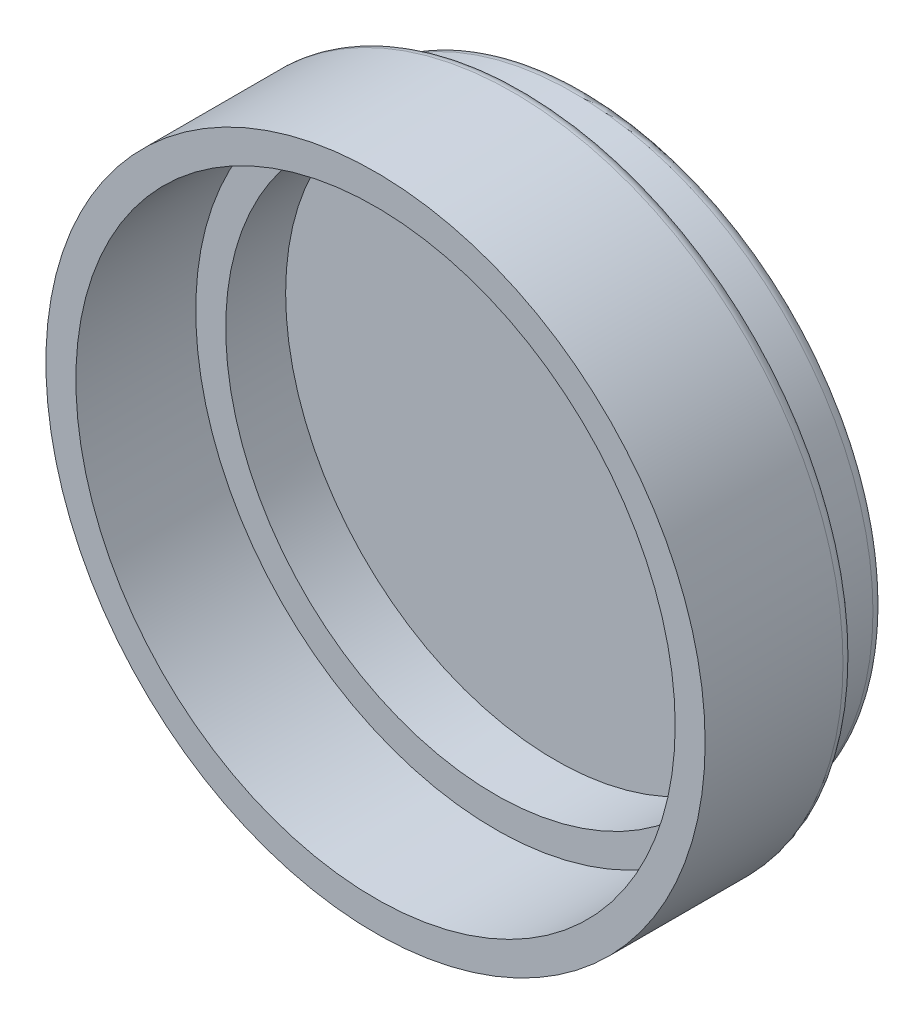
from build123d import *

# Parameters (mm, degrees)
ESBO_O1_R                = 55
RESSALTO_EXTRUS_O1_DEPTH = 25
ESBO_O2_R                = 50
RESSALTO_EXTRUS_O2_DEPTH = 10
CASCA1_T                 = -5
FILETE2_R                = 2
FILETE3_R                = 2


with BuildPart() as part:
    # Esboço1 → Ressalto-extrusão1 (new body)
    with BuildSketch(Plane.XY):
        Circle(ESBO_O1_R)
    extrude(amount=RESSALTO_EXTRUS_O1_DEPTH)

    # Esboço2 → Ressalto-extrusão2 (add)
    with BuildSketch(Plane(origin=(0, 0, 0), x_dir=(-1, 0, 0), z_dir=(0, 0, -1))):
        Circle(ESBO_O2_R)
    extrude(amount=RESSALTO_EXTRUS_O2_DEPTH)

    # Casca1
    casca1_openings = [part.faces().sort_by_distance(p)[0] for p in [
        (0, 0, 25),
    ]]
    offset(amount=CASCA1_T, openings=casca1_openings, kind=Kind.INTERSECTION)

    # Filete2
    filete2_edges = [part.edges().sort_by_distance(p)[0] for p in [
        (50, 0, 0),
        (50, 0, -10),
    ]]
    fillet(filete2_edges, radius=FILETE2_R)

    # Filete3
    filete3_edges = [part.edges().sort_by_distance(p)[0] for p in [
        (-55, 0, 0),
    ]]
    fillet(filete3_edges, radius=FILETE3_R)


solid = part.part
